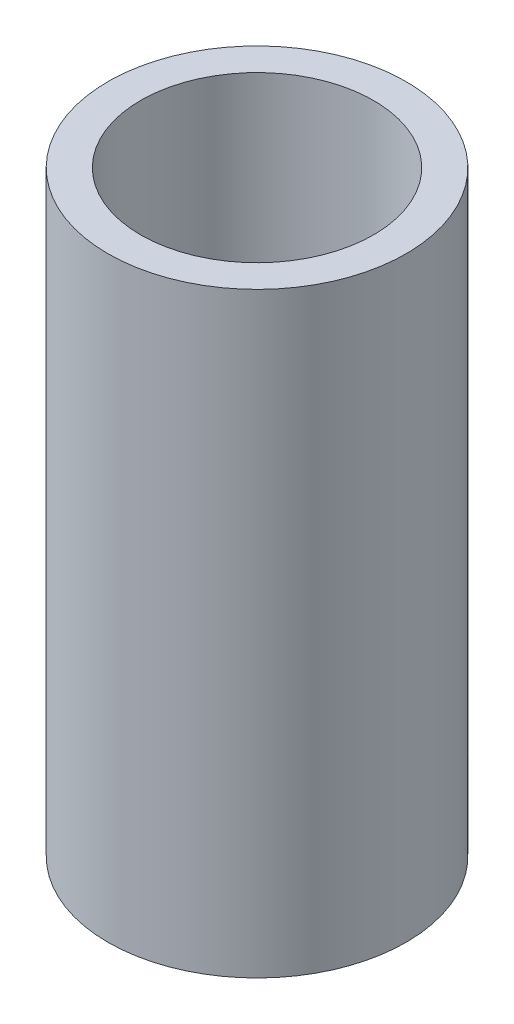
from build123d import *

# Parameters (mm, degrees)
SKETCH1_R           = 5.08
SKETCH1_R_2         = 3.96875
BOSS_EXTRUDE1_DEPTH = 20.32


with BuildPart() as part:
    # Sketch1 → Boss-Extrude1 (new body)
    with BuildSketch(Plane(origin=(0, 0, 0), x_dir=(1, 0, 0), z_dir=(0, 1, 0))):
        with Locations(Location((0, 0, 0), (0, 0, 270))):
            Circle(SKETCH1_R)
        with Locations(Location((0, 0, 0), (0, 0, 270))):
            Circle(SKETCH1_R_2, mode=Mode.SUBTRACT)
    extrude(amount=-BOSS_EXTRUDE1_DEPTH)


solid = part.part
